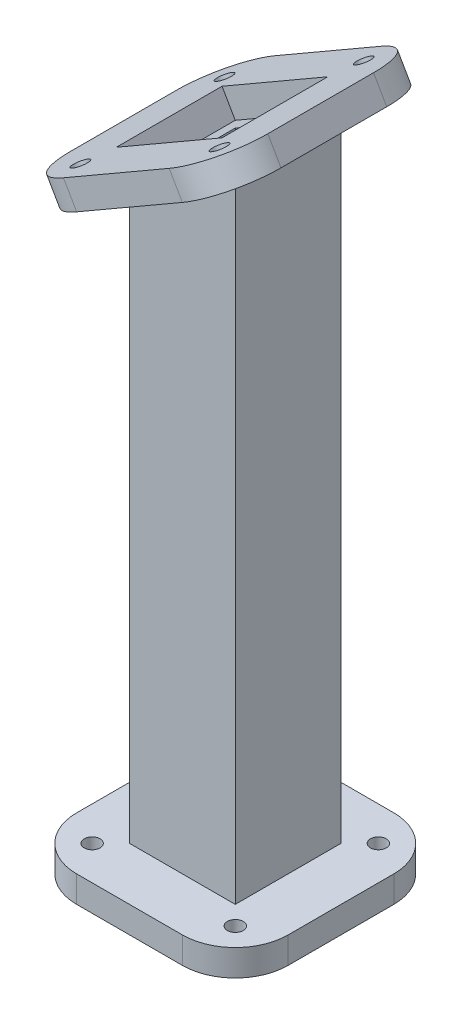
from build123d import *

# Parameters (mm, degrees)
BOSS_EXTRU_1_DEPTH = 20
COQUE1_T           = -3
ESQUISSE2_R        = 1.5
ESQUISSE2_W        = 20
ESQUISSE2_H        = 20
BOSS_EXTRU_2_DEPTH = 5
ESQUISSE3_R        = 1.5
ESQUISSE3_W        = 23.094010768
ESQUISSE3_H        = 20
BOSS_EXTRU_3_DEPTH = 5


with BuildPart() as part:
    # Esquisse1 → Boss.-Extru.1 (new body)
    with BuildSketch(Plane.XY):
        Polygon((10, 60), (-10, 48.452994616), (-10, -60), (10, -60), align=None)
    extrude(amount=BOSS_EXTRU_1_DEPTH)

    # Coque1
    coque1_openings = [part.faces().sort_by_distance(p)[0] for p in [
        (0, -60, 10),
        (0, 54.226497308, 10),
    ]]
    offset(amount=COQUE1_T, openings=coque1_openings, kind=Kind.INTERSECTION)


with BuildPart() as body_2:
    # Esquisse2 → Boss.-Extru.2 (new body)
    with BuildSketch(Plane.XZ.offset(60)):
        with BuildLine():
            Line((-20, 20), (-20, 0))
            ThreePointArc((-20, 0), (-17.071067812, -7.071067812), (-10, -10))
            Line((-10, -10), (10, -10))
            ThreePointArc((10, -10), (17.071067812, -7.071067812), (20, 0))
            Line((20, 0), (20, 20))
            ThreePointArc((20, 20), (17.071067812, 27.071067812), (10, 30))
            Line((10, 30), (-10, 30))
            ThreePointArc((-10, 30), (-17.071067812, 27.071067812), (-20, 20))
        make_face()
        with Locations(Location((-13.535533906, 23.535533906, 0), (0, 0, 270))):
            Circle(ESQUISSE2_R, mode=Mode.SUBTRACT)
        with Locations(Location((13.535533906, 23.535533906, 0), (0, 0, 270))):
            Circle(ESQUISSE2_R, mode=Mode.SUBTRACT)
        with Locations(Location((13.535533906, -3.535533906, 0), (0, 0, 270))):
            Circle(ESQUISSE2_R, mode=Mode.SUBTRACT)
        with Locations(Location((-13.535533906, -3.535533906, 0), (0, 0, 270))):
            Circle(ESQUISSE2_R, mode=Mode.SUBTRACT)
        with Locations((0, 10)):
            Rectangle(ESQUISSE2_W, ESQUISSE2_H, mode=Mode.SUBTRACT)
    extrude(amount=BOSS_EXTRU_2_DEPTH)


with BuildPart() as body_3:
    # Esquisse3 → Boss.-Extru.3 (new body)
    with BuildSketch(Plane(origin=(-23.480762114, 40.669872981, 0), x_dir=(0.8660254037844415, 0.49999999999999517, 0), z_dir=(-0.4999999999999951, 0.8660254037844414, 0))):
        with BuildLine():
            Line((38.660254038, 10), (15.56624327, 10))
            ThreePointArc((15.56624327, 10), (8.495175458, 7.071067812), (5.56624327, 0))
            Line((5.56624327, 0), (5.56624327, -20))
            ThreePointArc((5.56624327, -20), (8.495175458, -27.071067812), (15.56624327, -30))
            Line((15.56624327, -30), (38.660254038, -30))
            ThreePointArc((38.660254038, -30), (45.73132185, -27.071067812), (48.660254038, -20))
            Line((48.660254038, -20), (48.660254038, 0))
            ThreePointArc((48.660254038, 0), (45.73132185, 7.071067812), (38.660254038, 10))
        make_face()
        with Locations((12.030709364, 3.535533906)):
            Circle(ESQUISSE3_R, mode=Mode.SUBTRACT)
        with Locations((40.64878256, 5.08253929)):
            Circle(ESQUISSE3_R, mode=Mode.SUBTRACT)
        with Locations((42.195787944, -23.535533906)):
            Circle(ESQUISSE3_R, mode=Mode.SUBTRACT)
        with Locations((13.577714748, -25.08253929)):
            Circle(ESQUISSE3_R, mode=Mode.SUBTRACT)
        with Locations((27.113248654, -10)):
            Rectangle(ESQUISSE3_W, ESQUISSE3_H, mode=Mode.SUBTRACT)
    extrude(amount=BOSS_EXTRU_3_DEPTH)


solid = Compound([part.part, body_2.part, body_3.part])
